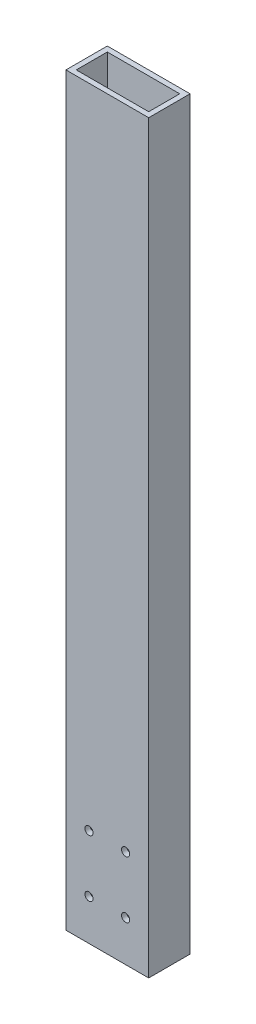
from build123d import *

# Parameters (mm, degrees)
SKETCH1_W           = 50.8
SKETCH1_H           = 25.4
SKETCH1_W_2         = 44.45
SKETCH1_H_2         = 19.05
BOSS_EXTRUDE1_DEPTH = 457.2
SKETCH2_R           = 2.5
CUT_EXTRUDE1_DEPTH  = 459.608940166


with BuildPart() as part:
    # Sketch1 → Boss-Extrude1 (new body)
    with BuildSketch(Plane(origin=(0, 0, 0), x_dir=(1, 0, 0), z_dir=(0, 1, 0))):
        Rectangle(SKETCH1_W, SKETCH1_H)
        Rectangle(SKETCH1_W_2, SKETCH1_H_2, mode=Mode.SUBTRACT)
    extrude(amount=BOSS_EXTRUDE1_DEPTH)

    # Sketch2 → Cut-Extrude1 (cut, through all)
    with BuildSketch(Plane.XY.offset(12.7)):
        with Locations((-11.25, 60)):
            Circle(SKETCH2_R)
        with Locations((-11.25, 25)):
            Circle(SKETCH2_R)
        with Locations((11.25, 25)):
            Circle(SKETCH2_R)
        with Locations((11.25, 60)):
            Circle(SKETCH2_R)
    extrude(amount=-CUT_EXTRUDE1_DEPTH, mode=Mode.SUBTRACT)


solid = part.part
